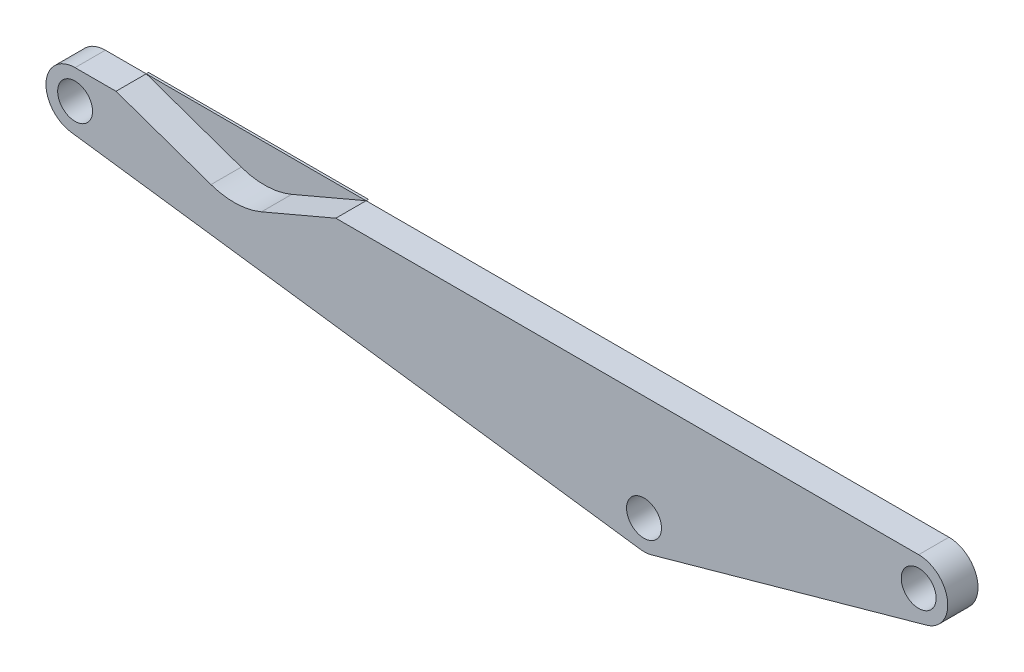
from build123d import *

# Parameters (mm, degrees)
SKETCH_1_R          = 0.75
EXTRUDE_1_DEPTH     = 0.65
CUT_EXTRUDE_1_DEPTH = 10
EXTRUDE_3_DEPTH     = 0.1


with BuildPart() as part:
    # 草圖1 → 填料-伸長1 (new, symmetric)
    with BuildSketch(Plane.XY):
        with BuildLine():
            Line((0, 1.25), (36.24, 1.25))
            ThreePointArc((36.24, 1.25), (37.478474488, 0.169354485), (36.575585934, -1.204110494))
            Line((36.575585934, -1.204110494), (24.775303098, -4.492852651))
            ThreePointArc((24.775303098, -4.492852651), (24.525924375, -4.535765941), (24.273012877, -4.527576158))
            Line((24.273012877, -4.527576158), (-0.166704286, -1.238834001))
            ThreePointArc((-0.166704286, -1.238834001), (-1.247205376, 0.083538911), (0, 1.25))
        make_face()
        Circle(SKETCH_1_R, mode=Mode.SUBTRACT)
        with Locations((36.24, 0)):
            Circle(SKETCH_1_R, mode=Mode.SUBTRACT)
        with Locations((24.439717163, -3.288742157)):
            Circle(SKETCH_1_R, mode=Mode.SUBTRACT)
    extrude(amount=EXTRUDE_1_DEPTH, both=True)

    # 草圖2 → 除料-伸長1 (cut)
    with BuildSketch(Plane.XY.offset(0.65)):
        with BuildLine():
            Line((1.757329147, 1.25), (5.83713676, -0.181882718))
            ThreePointArc((5.83713676, -0.181882718), (6.928296403, -0.349573027), (8.006230293, -0.111228877))
            Line((8.006230293, -0.111228877), (11.20211131, 1.25))
            Line((11.20211131, 1.25), (1.757329147, 1.25))
        make_face()
    extrude(amount=-CUT_EXTRUDE_1_DEPTH, mode=Mode.SUBTRACT)


with BuildPart() as body_2:
    # 草圖4 → 填料-伸長3 (new body)
    with BuildSketch(Plane(origin=(0, 0, -0.65), x_dir=(-1, 0, 0), z_dir=(0, 0, -1))):
        with BuildLine():
            Line((-8.006230293, -0.111228877), (-11.20211131, 1.25))
            Line((-11.20211131, 1.25), (-1.757329147, 1.25))
            Line((-1.757329147, 1.25), (-5.83713676, -0.181882718))
            ThreePointArc((-5.83713676, -0.181882718), (-6.928296403, -0.349573027), (-8.006230293, -0.111228877))
        make_face()
    extrude(amount=EXTRUDE_3_DEPTH)


solid = Compound([part.part, body_2.part])
